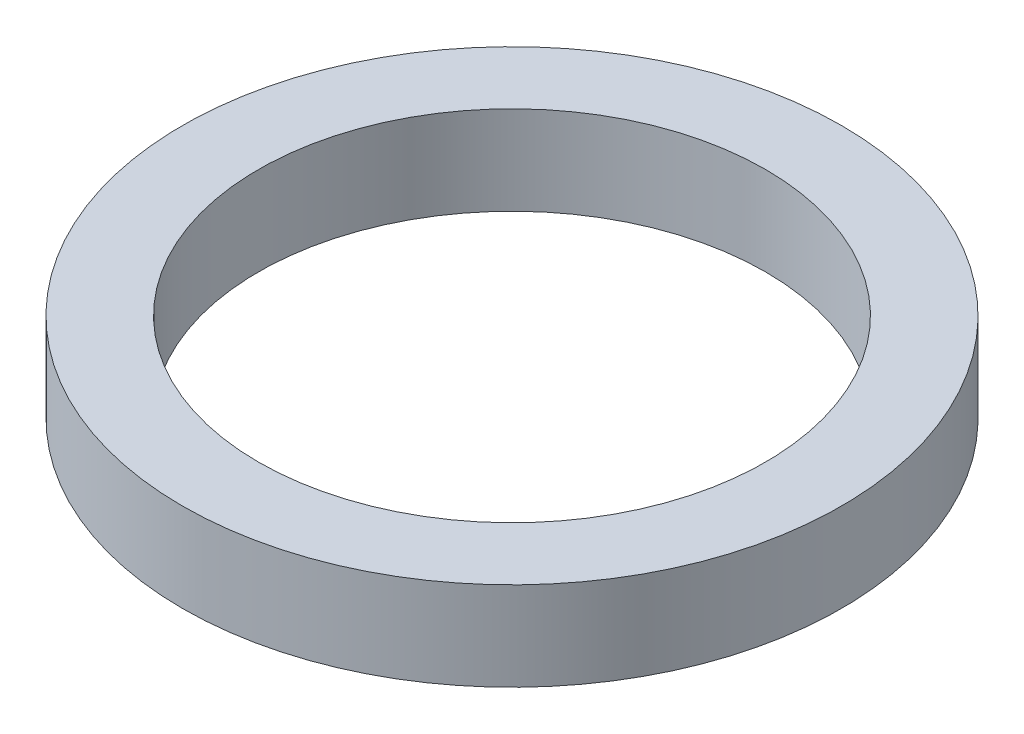
from build123d import *

# Parameters (mm, degrees)
SKETCH1_R           = 26
SKETCH1_R_2         = 20
BOSS_EXTRUDE1_DEPTH = 7


with BuildPart() as part:
    # Sketch1 → Boss-Extrude1 (new body)
    with BuildSketch(Plane(origin=(0, 0, 0), x_dir=(1, 0, 0), z_dir=(0, 1, 0))):
        with Locations(Location((0, 0, 0), (0, 0, 270))):
            Circle(SKETCH1_R)
        with Locations(Location((0, 0, 0), (0, 0, 270))):
            Circle(SKETCH1_R_2, mode=Mode.SUBTRACT)
    extrude(amount=BOSS_EXTRUDE1_DEPTH)


solid = part.part
